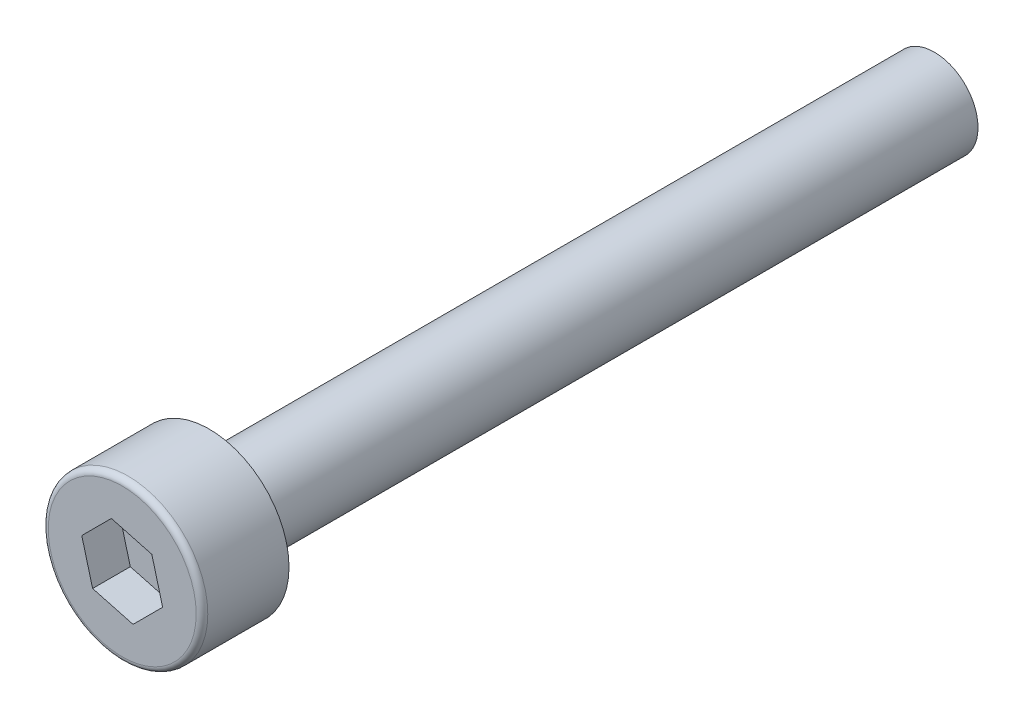
from build123d import *

# Parameters (mm, degrees)
SKETCH_1_R          = 2.75
EXTRUDE_1_DEPTH     = 3
CUT_EXTRUDE_1_DEPTH = 1.3
SKETCH_3_R          = 1.5
EXTRUDE_2_DEPTH     = 25
FILLET_1_R          = 0.2


with BuildPart() as part:
    # 草图1 → 凸台-拉伸1 (new body)
    with BuildSketch(Plane.XY):
        Circle(SKETCH_1_R)
    extrude(amount=EXTRUDE_1_DEPTH)

    # 草图2 → 切除-拉伸1 (cut)
    with BuildSketch(Plane.XY.offset(3)):
        Polygon((-1.020620726, -1.020620726), (0.373573113, -1.39419384), (1.39419384, -0.373573113), (1.020620726, 1.020620726), (-0.373573113, 1.39419384), (-1.39419384, 0.373573113), align=None)
    extrude(amount=-CUT_EXTRUDE_1_DEPTH, mode=Mode.SUBTRACT)

    # 草图3 → 凸台-拉伸2 (add)
    with BuildSketch(Plane(origin=(0, 0, 0), x_dir=(-1, 0, 0), z_dir=(0, 0, -1))):
        with Locations(Location((0, 0, 0), (0, 0, 180))):
            Circle(SKETCH_3_R)
    extrude(amount=EXTRUDE_2_DEPTH)

    # 圆角1
    fillet_1_edges = [part.edges().sort_by_distance(p)[0] for p in [
        (-2.75, 0, 3),
    ]]
    fillet(fillet_1_edges, radius=FILLET_1_R)


solid = part.part
